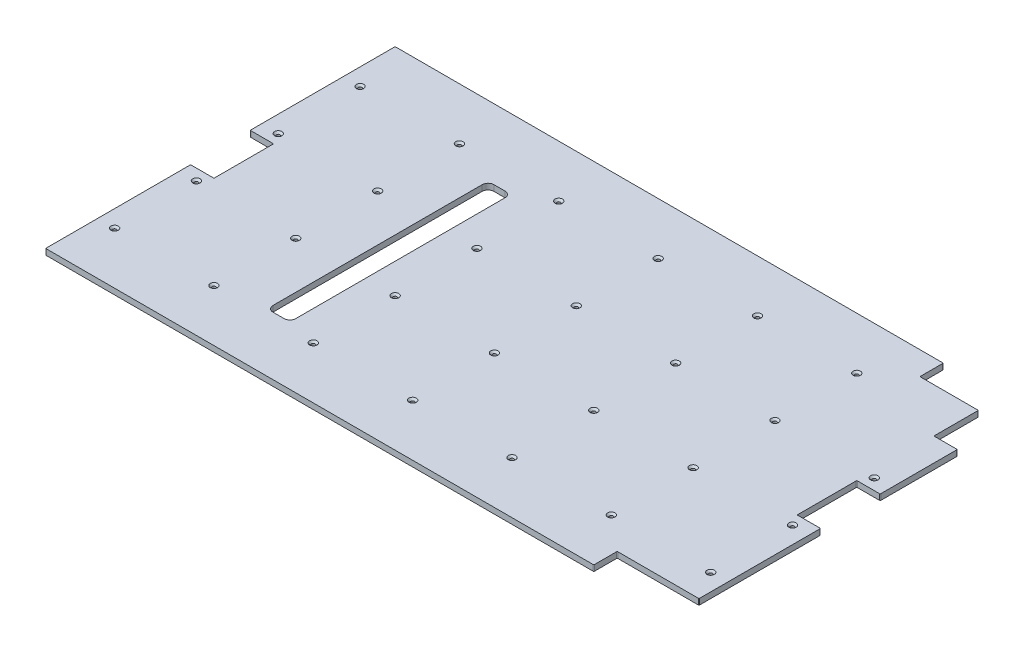
from build123d import *

# Parameters (mm, degrees)
SKETCH1_W                                       = 539
SKETCH1_H                                       = 299
BOSS_EXTRUDE1_DEPTH                             = 5
SKETCH2_W                                       = 20
SKETCH2_H                                       = 51
CUT_EXTRUDE1_DEPTH                              = 309.229622197
CSK_FOR_M3_FLAT_HEAD_MACHINE_SCREW1_D           = 3.2
CSK_FOR_M3_FLAT_HEAD_MACHINE_SCREW1_CSINK_D     = 6.3
CSK_FOR_M3_FLAT_HEAD_MACHINE_SCREW1_CSINK_ANGLE = 90
LPATTERN1_COUNT                                 = 7
LPATTERN1_PITCH                                 = 85
LPATTERN1_COUNT_DIR2                            = 4
LPATTERN1_PITCH_DIR2                            = 70
CUT_EXTRUDE2_DEPTH                              = 309.229622197
CUT_EXTRUDE3_DEPTH                              = 309.229622197
CUT_EXTRUDE3_DEPTH_BACK                         = 309.229622197
SKETCH6_W                                       = 70
SKETCH6_H                                       = 20
FILLET1_R                                       = 0.5


with BuildPart() as part:
    # Sketch1 → Boss-Extrude1 (new body)
    with BuildSketch(Plane(origin=(0, 0, 0), x_dir=(1, 0, 0), z_dir=(0, 1, 0))):
        Rectangle(SKETCH1_W, SKETCH1_H)
    extrude(amount=BOSS_EXTRUDE1_DEPTH)

    # Sketch2 → Cut-Extrude1 (cut, through all)
    with BuildSketch(Plane(origin=(0, 5, 0), x_dir=(1, 0, 0), z_dir=(0, 1, 0))):
        with Locations((-259.5, 0)):
            Rectangle(SKETCH2_W, SKETCH2_H)
    cut_extrude1 = extrude(amount=-CUT_EXTRUDE1_DEPTH, mode=Mode.SUBTRACT)

    # Mirror1: Cut-Extrude1 across plane
    add(cut_extrude1.mirror(Plane(origin=(0, 0, 0), x_dir=(0, 0, 1), z_dir=(1, 0, 0))), mode=Mode.SUBTRACT)

    # CSK for M3 Flat Head Machine Screw1 (through all)
    with Locations(Plane(origin=(-255, 5, 105), x_dir=(0, 0, 1), z_dir=(0, 1, 0))):
        with Locations((0, 0)):
            csk_for_m3_flat_head_machine_screw1 = CounterSinkHole(CSK_FOR_M3_FLAT_HEAD_MACHINE_SCREW1_D / 2, CSK_FOR_M3_FLAT_HEAD_MACHINE_SCREW1_CSINK_D / 2, counter_sink_angle=CSK_FOR_M3_FLAT_HEAD_MACHINE_SCREW1_CSINK_ANGLE)

    # LPattern1: CSK for M3 Flat Head Machine Screw1 7 × 4
    with Locations(*[(i * LPATTERN1_PITCH, 0, -j * LPATTERN1_PITCH_DIR2) for i in range(LPATTERN1_COUNT) for j in range(LPATTERN1_COUNT_DIR2) if (i, j) != (0, 0)]):
        add(csk_for_m3_flat_head_machine_screw1, mode=Mode.SUBTRACT)

    # Sketch5 → Cut-Extrude2 (cut, through all)
    with BuildSketch(Plane(origin=(0, 5, 0), x_dir=(1, 0, 0), z_dir=(0, 1, 0))):
        with BuildLine():
            Line((-130, -94.5), (-130, 83.5))
            Line((-130, 83.5), (-130, 84.5))
            ThreePointArc((-130, 84.5), (-128.535533906, 88.035533906), (-125, 89.5))
            Line((-125, 89.5), (-115.5, 89.5))
            ThreePointArc((-115.5, 89.5), (-111.964466094, 88.035533906), (-110.5, 84.5))
            Line((-110.5, 84.5), (-110.5, -93.5))
            Line((-110.5, -93.5), (-110.5, -94.5))
            ThreePointArc((-110.5, -94.5), (-111.964466094, -98.035533906), (-115.5, -99.5))
            Line((-115.5, -99.5), (-125, -99.5))
            ThreePointArc((-125, -99.5), (-128.535533906, -98.035533906), (-130, -94.5))
        make_face()
    extrude(amount=-CUT_EXTRUDE2_DEPTH, mode=Mode.SUBTRACT)

    # Sketch6 → Cut-Extrude3 (cut, two sides: drawn at the far end of the back side and taken through both)
    with BuildSketch(Plane(origin=(0, 5, 0), x_dir=(1, 0, 0), z_dir=(0, 1, 0)).offset(-CUT_EXTRUDE3_DEPTH_BACK)):
        Polygon((199.5, 149.5), (199.5, 129.5), (249.5, 129.5), (249.5, 91.5), (269.5, 91.5), (269.5, 149.5), align=None)
        with Locations((234.5, -139.5)):
            Rectangle(SKETCH6_W, SKETCH6_H)
    extrude(amount=CUT_EXTRUDE3_DEPTH + CUT_EXTRUDE3_DEPTH_BACK, mode=Mode.SUBTRACT)

    # Fillet1
    fillet1_edges = [part.edges().sort_by_distance(p)[0] for p in [
        (-269.5, 2.5, 25.5),
        (-269.5, 2.5, -25.5),
        (-249.5, 2.5, -25.5),
        (-249.5, 2.5, 25.5),
        (199.5, 2.5, -149.5),
        (269.5, 2.5, -91.5),
        (249.5, 2.5, -91.5),
        (249.5, 2.5, -129.5),
        (199.5, 2.5, -129.5),
        (269.5, 2.5, 129.5),
        (199.5, 2.5, 149.5),
        (199.5, 2.5, 129.5),
        (269.5, 2.5, -25.5),
        (269.5, 2.5, 25.5),
        (249.5, 2.5, 25.5),
        (249.5, 2.5, -25.5),
        (-269.5, 2.5, -149.5),
        (-269.5, 2.5, 149.5),
    ]]
    fillet(fillet1_edges, radius=FILLET1_R)


solid = part.part
